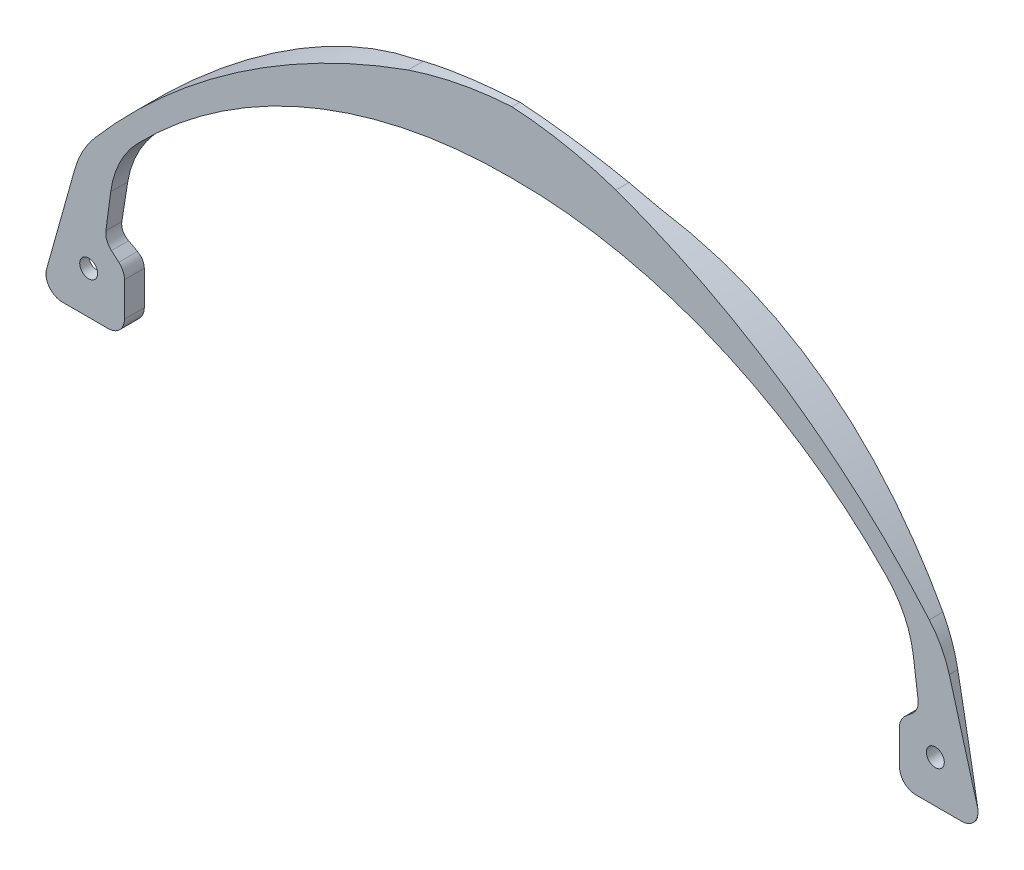
from build123d import *

# Parameters (mm, degrees)
ESQUISSE2_R             = 2.75
BOSS_EXTRU_1_DEPTH      = 12
CONG_1_R                = 30
CONG_2_R                = 30
CONG_3_R                = 5
CONG_4_R                = 5
CONG_5_R                = 5
CONG_6_R                = 5
CONG_1_OF_SYM_TRIE1_R   = 30
CONG_2_OF_SYM_TRIE1_R   = 30
CONG_3_OF_SYM_TRIE1_R   = 5
CONG_4_OF_SYM_TRIE1_R   = 5
CONG_5_OF_SYM_TRIE1_R   = 5
CONG_6_OF_SYM_TRIE1_R   = 5
ENL_V_MAT_EXTRU_6_DEPTH = 153


with BuildPart() as part:
    # Esquisse2 → Boss.-Extru.1 (new body)
    with BuildSketch(Plane.XY):
        with BuildLine():
            Line((-125.064319956, 10), (-122, 33))
            ThreePointArc((-122, 33), (-67.197277761, 74.501212265), (0, 89))
            Line((0, 89), (0, 108))
            ThreePointArc((0, 108), (-16.165722488, 105.975834437), (-31.918403878, 101.818809198))
            ThreePointArc((-31.918403878, 101.818809198), (-87.157005326, 72.996548183), (-132.564319956, 30.332727469))
            Line((-132.564319956, 30.332727469), (-144.7, -13))
            Line((-144.7, -13), (-119, -13))
            Line((-119, -13), (-119, 4.782335439))
            Line((-119, 4.782335439), (-125.064319956, 10))
        make_face()
        with Locations((-130, 0)):
            Circle(ESQUISSE2_R, mode=Mode.SUBTRACT)
    boss_extru_1 = extrude(amount=BOSS_EXTRU_1_DEPTH)

    # Congé1
    cong_1_edges = [part.edges().sort_by_distance(p)[0] for p in [
        (-132.564319956, 30.332727469, 6),
    ]]
    fillet(cong_1_edges, radius=CONG_1_R)

    # Congé2
    cong_2_edges = [part.edges().sort_by_distance(p)[0] for p in [
        (-122, 33, 6),
    ]]
    fillet(cong_2_edges, radius=CONG_2_R)

    # Congé3
    cong_3_edges = [part.edges().sort_by_distance(p)[0] for p in [
        (-125.064319956, 10, 6),
    ]]
    fillet(cong_3_edges, radius=CONG_3_R)

    # Congé4
    cong_4_edges = [part.edges().sort_by_distance(p)[0] for p in [
        (-119, 4.782335439, 6),
    ]]
    fillet(cong_4_edges, radius=CONG_4_R)

    # Congé5
    cong_5_edges = [part.edges().sort_by_distance(p)[0] for p in [
        (-119, -13, 6),
    ]]
    fillet(cong_5_edges, radius=CONG_5_R)

    # Congé6
    cong_6_edges = [part.edges().sort_by_distance(p)[0] for p in [
        (-144.7, -13, 6),
    ]]
    fillet(cong_6_edges, radius=CONG_6_R)

    # Symétrie1: Boss.-Extru.1 across plane
    add(boss_extru_1.mirror(Plane(origin=(0, 108, 12), x_dir=(0, 0, 1), z_dir=(-1, 0, 0))))

    # Congé1 of Symétrie1
    cong_1_of_sym_trie1_edges = [part.edges().sort_by_distance(p)[0] for p in [
        (132.564319956, 30.332727469, 6),
    ]]
    fillet(cong_1_of_sym_trie1_edges, radius=CONG_1_OF_SYM_TRIE1_R)

    # Congé2 of Symétrie1
    cong_2_of_sym_trie1_edges = [part.edges().sort_by_distance(p)[0] for p in [
        (122, 33, 6),
    ]]
    fillet(cong_2_of_sym_trie1_edges, radius=CONG_2_OF_SYM_TRIE1_R)

    # Congé3 of Symétrie1
    cong_3_of_sym_trie1_edges = [part.edges().sort_by_distance(p)[0] for p in [
        (125.064319956, 10, 6),
    ]]
    fillet(cong_3_of_sym_trie1_edges, radius=CONG_3_OF_SYM_TRIE1_R)

    # Congé4 of Symétrie1
    cong_4_of_sym_trie1_edges = [part.edges().sort_by_distance(p)[0] for p in [
        (119, 4.782335439, 6),
    ]]
    fillet(cong_4_of_sym_trie1_edges, radius=CONG_4_OF_SYM_TRIE1_R)

    # Congé5 of Symétrie1
    cong_5_of_sym_trie1_edges = [part.edges().sort_by_distance(p)[0] for p in [
        (119, -13, 6),
    ]]
    fillet(cong_5_of_sym_trie1_edges, radius=CONG_5_OF_SYM_TRIE1_R)

    # Congé6 of Symétrie1
    cong_6_of_sym_trie1_edges = [part.edges().sort_by_distance(p)[0] for p in [
        (144.7, -13, 6),
    ]]
    fillet(cong_6_of_sym_trie1_edges, radius=CONG_6_OF_SYM_TRIE1_R)

    # Esquisse9 → Enlèv. mat.-Extru.6 (cut)
    with BuildSketch(Plane(origin=(0, 108, 0), x_dir=(1, 0, 0), z_dir=(0, 1, 0))):
        with BuildLine():
            Line((143.107329358, -12), (143.107329358, 11.686377944))
            Line((143.107329358, 11.686377944), (-142.922076855, 11.686377944))
            Line((-142.922076855, 11.686377944), (-142.922076855, -12))
            ThreePointArc((-142.922076855, -12), (-88.956734655, -2.351996966), (-34.333129967, -7))
            ThreePointArc((-34.333129967, -7), (2.833435017, -9.579184192), (40, -7))
            ThreePointArc((40, -7), (91.882795923, -2.712831285), (143.107329358, -12))
        make_face()
    extrude(amount=-ENL_V_MAT_EXTRU_6_DEPTH, mode=Mode.SUBTRACT)


with BuildPart() as enl_v_mat_extru_6_piece_1:
    # of the separate pieces the step leaves, piece 1, a body of its own (enl_v_mat_extru_6_pieces)
    add(part.part.solids().sort_by_distance((138.107329358, -13, 10.46895452))[0])


with BuildPart() as enl_v_mat_extru_6_piece_2:
    # of the separate pieces the step leaves, piece 2, a body of its own (enl_v_mat_extru_6_pieces)
    add(part.part.solids().sort_by_distance((-142.922076855, -6.651591106, 0))[0])


solid = Compound([enl_v_mat_extru_6_piece_1.part, enl_v_mat_extru_6_piece_2.part])
